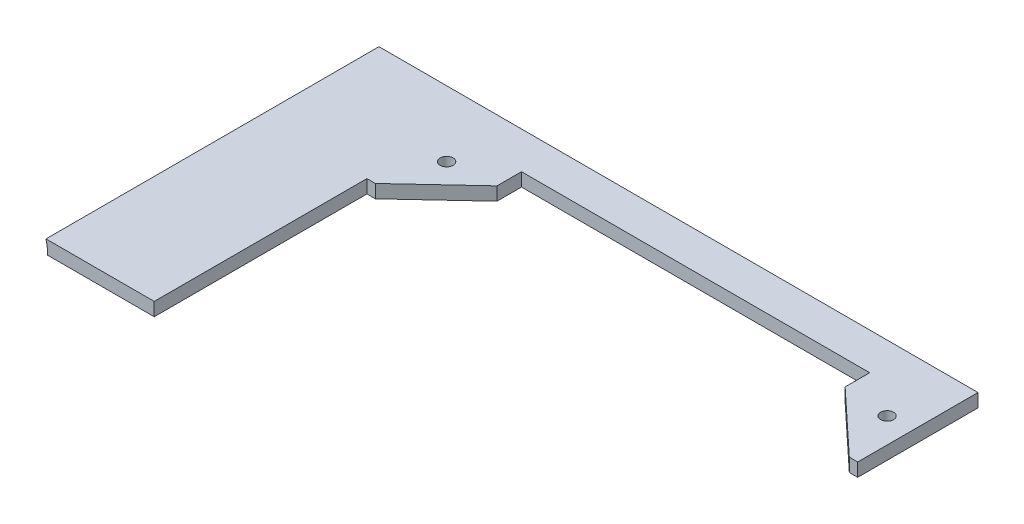
from build123d import *

# Parameters (mm, degrees)
SKETCH1_W            = 190.5
SKETCH1_H            = 76.2
BOSS_EXTRUDE1_DEPTH  = 3.175
SKETCH2_R            = 1.545336663
CUT_EXTRUDE4_DEPTH   = 103.636509708
SKETCH3_W            = 153.75
SKETCH3_H            = 3.175
BOSS_EXTRUDE2_DEPTH  = 3.175
CUT_SWEEP1_PROFILE_R = 12.7


with BuildPart() as part:
    # Sketch1 → Boss-Extrude1 (new body)
    with BuildSketch(Plane(origin=(0, 0, 0), x_dir=(1, 0, 0), z_dir=(0, 1, 0))):
        Rectangle(SKETCH1_W, SKETCH1_H)
    extrude(amount=BOSS_EXTRUDE1_DEPTH)

    # Sketch2 → Cut-Extrude4 (cut, through all)
    with BuildSketch(Plane(origin=(0, 3.175, 0), x_dir=(1, 0, 0), z_dir=(0, 1, 0))):
        Polygon((-58.5, 12.6), (-58.5, -38.1), (95.25, -38.1), (95.25, 38.1), (58.5, 38.1), (58.5, 12.6), (56.5, 12.6), (41.5, 26.6), (41.5, 32.45), (-41.5, 32.45), (-41.5, 26.6), (-56.5, 12.6), align=None)
        with Locations(Location((-52.505245516, 25.605245516, 0), (0, 0, 270))):
            Circle(SKETCH2_R)
        with Locations(Location((52.5, 25.605245516, 0), (0, 0, 270))):
            Circle(SKETCH2_R)
    extrude(amount=-CUT_EXTRUDE4_DEPTH, mode=Mode.SUBTRACT)

    # Sketch3 → Boss-Extrude2 (add)
    with BuildSketch(Plane(origin=(0, 0, -38.1), x_dir=(-1, 0, 0), z_dir=(0, 0, -1))):
        with Locations((18.375, 1.5875)):
            Rectangle(SKETCH3_W, SKETCH3_H)
    extrude(amount=BOSS_EXTRUDE2_DEPTH)

    # Cut-Sweep1: sweep along a curve in space
    with BuildLine() as cut_sweep1_path:
        Line((-96.6, 0, -54.083912637), (-96.6, 0, 450.454630794))
    # Cut-Sweep1 profile (on start of the path) → Cut-Sweep1 (sweep, cut)
    with BuildSketch(Plane(origin=(-96.6, 0, -54.083912637), x_dir=(0, 1, 0), z_dir=(0, 0, 1))):
        Circle(CUT_SWEEP1_PROFILE_R)
    sweep(path=cut_sweep1_path.line, mode=Mode.SUBTRACT)


solid = part.part
